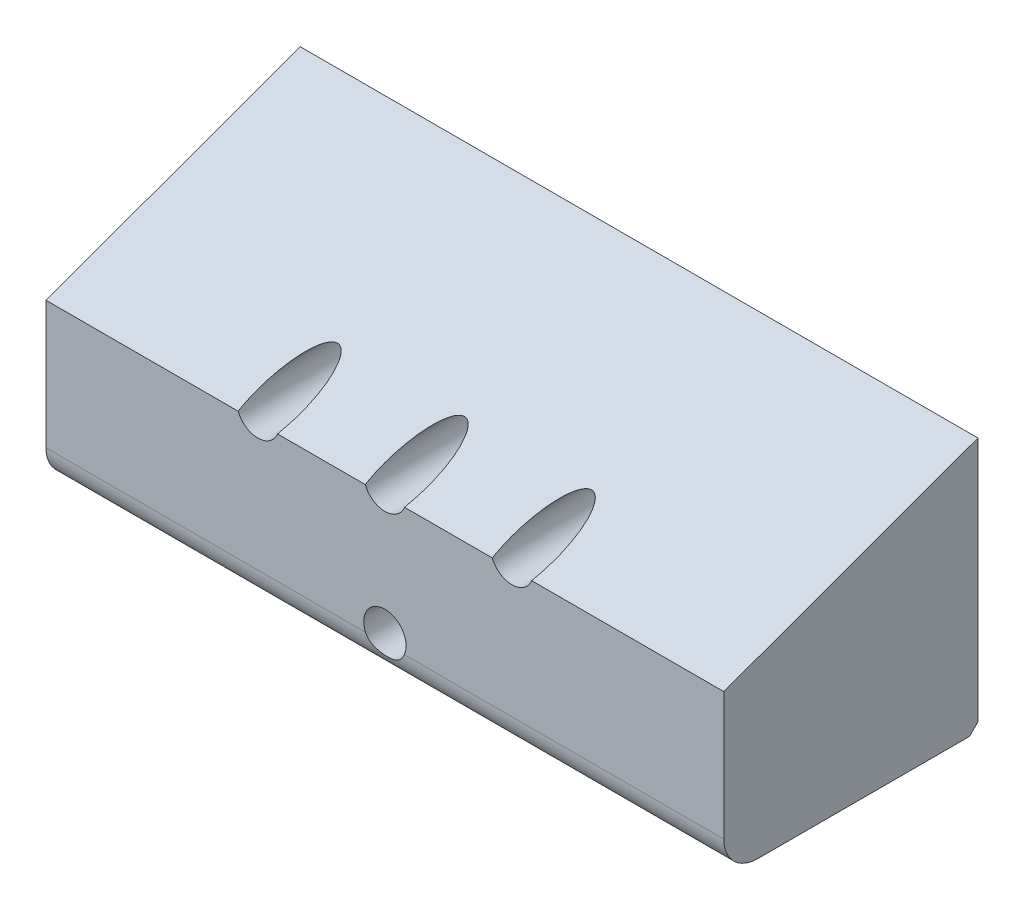
from build123d import *

# Parameters (mm, degrees)
EXTRUDE_1_DEPTH     = 40
FILLET_1_R          = 2
CHAMFER_2_SIZE      = 0.5
SKETCH_2_R          = 1.25
CUT_EXTRUDE_1_DEPTH = 44.772367073


with BuildPart() as part:
    # 草图1 → 凸台-拉伸1 (new body)
    with BuildSketch(Plane(origin=(0, 0, 0), x_dir=(0, 0, -1), z_dir=(1, 0, 0))):
        Polygon((0, 0), (15, 5.459553514), (15, -9.540446486), (0, -9.540446486), align=None)
    extrude(amount=-EXTRUDE_1_DEPTH)

    # 圆角1
    fillet_1_edges = [part.edges().sort_by_distance(p)[0] for p in [
        (-20, -9.540446486, 0),
    ]]
    fillet(fillet_1_edges, radius=FILLET_1_R)

    # 倒角2
    chamfer_2_edges = [part.edges().sort_by_distance(p)[0] for p in [
        (-20, -9.540446486, -15),
    ]]
    chamfer(chamfer_2_edges, length=CHAMFER_2_SIZE)

    # 草图2 → 切除-拉伸1 (cut, through all)
    with BuildSketch(Plane(origin=(0, 0, -15), x_dir=(-1, 0, 0), z_dir=(0, 0, -1))):
        with Locations((20, 0.459553514)):
            Circle(SKETCH_2_R)
        with Locations((27.5, 0.459553514)):
            Circle(SKETCH_2_R)
        with Locations((12.5, 0.459553514)):
            Circle(SKETCH_2_R)
        with Locations((20, -7.040446486)):
            Circle(SKETCH_2_R)
    extrude(amount=-CUT_EXTRUDE_1_DEPTH, mode=Mode.SUBTRACT)


solid = part.part
